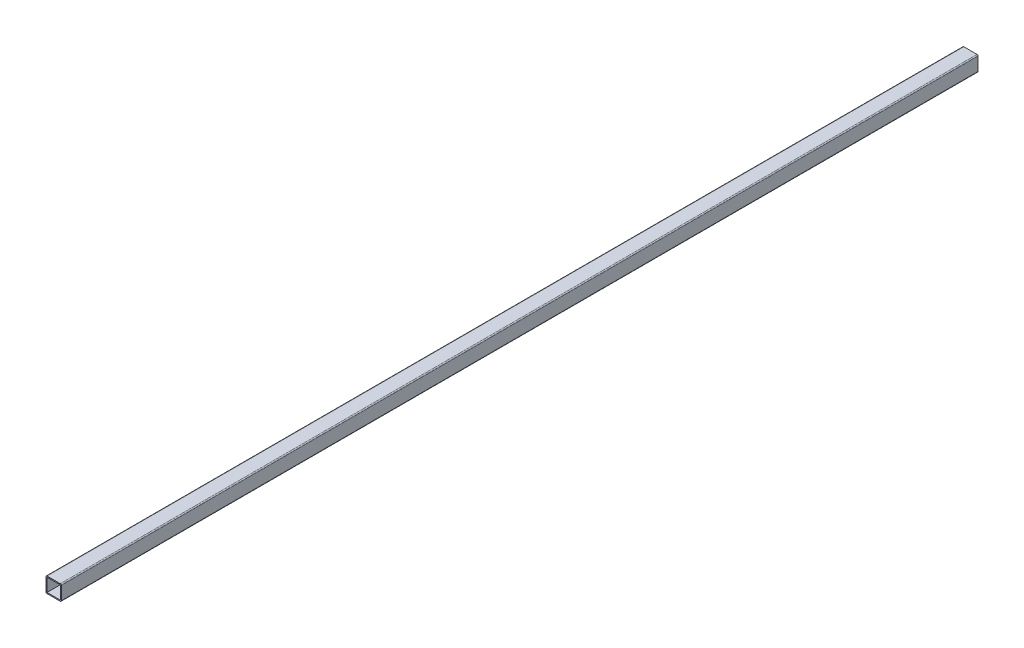
from build123d import *

# Parameters (mm, degrees)
SKETCH1_W           = 30
SKETCH1_H           = 30
SKETCH1_W_2         = 26
SKETCH1_H_2         = 26
BOSS_EXTRUDE1_DEPTH = 1800
FILLET1_R           = 2


with BuildPart() as part:
    # Sketch1 → Boss-Extrude1 (new body)
    with BuildSketch(Plane.XY):
        with Locations((-67.702702703, 21.081081081)):
            Rectangle(SKETCH1_W, SKETCH1_H)
        with Locations((-67.702702703, 21.081081081)):
            Rectangle(SKETCH1_W_2, SKETCH1_H_2, mode=Mode.SUBTRACT)
    extrude(amount=BOSS_EXTRUDE1_DEPTH)

    # Fillet1
    fillet1_edges = [part.edges().sort_by_distance(p)[0] for p in [
        (-82.702702703, 36.081081081, 900),
        (-52.702702703, 36.081081081, 900),
        (-52.702702703, 6.081081081, 900),
        (-82.702702703, 6.081081081, 900),
    ]]
    fillet(fillet1_edges, radius=FILLET1_R)


solid = part.part
